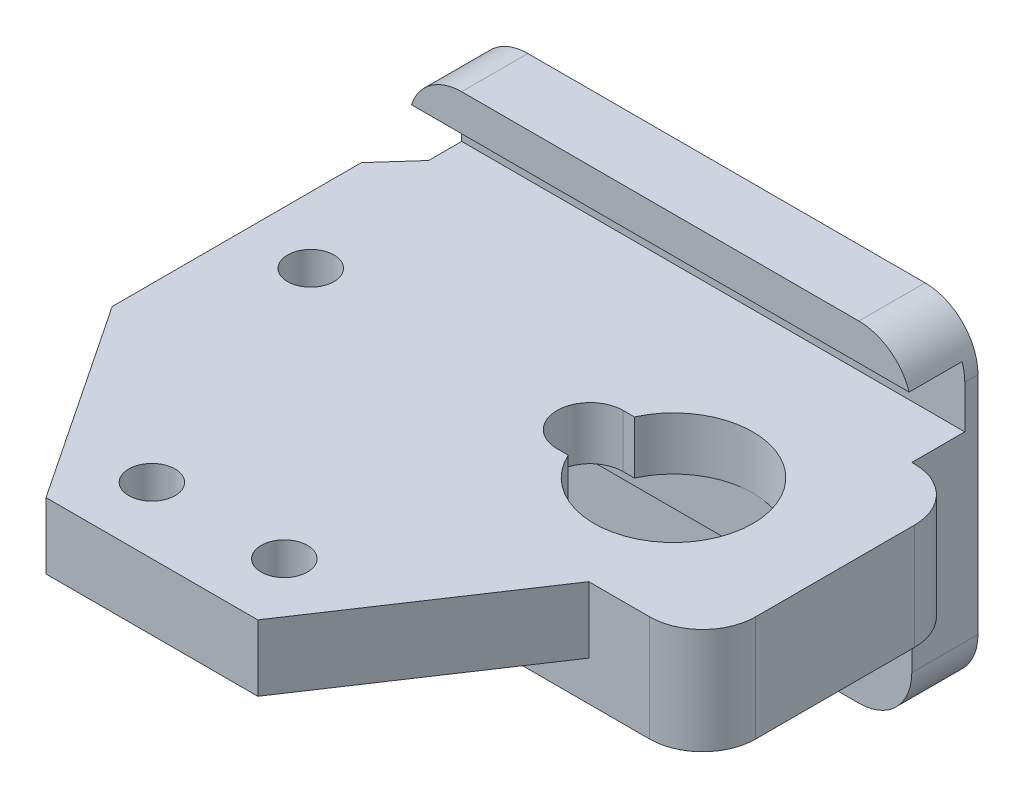
from build123d import *

# Parameters (mm, degrees)
SKETCH1_R           = 1.75
BOSS_EXTRUDE1_DEPTH = 5
SKETCH2_W           = 35
SKETCH2_H           = 20
SKETCH2_W_2         = 22.6
SKETCH2_H_2         = 12
BOSS_EXTRUDE2_DEPTH = 3
SKETCH3_W           = 15.4
SKETCH3_H           = 20
CUT_EXTRUDE1_DEPTH  = 76.166481892
SKETCH4_R           = 1
CUT_EXTRUDE2_DEPTH  = 7
SKETCH5_W           = 38
SKETCH5_H           = 25
BOSS_EXTRUDE3_DEPTH = 5
SKETCH6_R           = 2.3
CUT_EXTRUDE3_DEPTH  = 4
FILLET1_R           = 4
SKETCH2_2_W         = 22.6
SKETCH2_2_H         = 12
CUT_EXTRUDE4_DEPTH  = 1
CUT_EXTRUDE5_DEPTH  = 65.832264344
CUT_EXTRUDE6_DEPTH  = 65.627567647
SKETCH9_W           = 38
SKETCH9_H           = 4.5
CUT_EXTRUDE7_DEPTH  = 4


with BuildPart() as part:
    # Sketch1 → Boss-Extrude1 (new body)
    with BuildSketch(Plane(origin=(0, 0, 0), x_dir=(1, 0, 0), z_dir=(0, 1, 0))):
        Polygon((0, 15), (0, 33.819660113), (10, 45), (26, 45), (36, 35), (60, 35), (60, 15), (36, 15), (26, 0), (10, 0), align=None)
        with Locations((5, 25)):
            Circle(SKETCH1_R, mode=Mode.SUBTRACT)
        with Locations((13, 5)):
            Circle(SKETCH1_R, mode=Mode.SUBTRACT)
        with Locations((23, 5)):
            Circle(SKETCH1_R, mode=Mode.SUBTRACT)
    extrude(amount=BOSS_EXTRUDE1_DEPTH)

    # Sketch2 → Boss-Extrude2 (add)
    with BuildSketch(Plane.XZ):
        with Locations((27.1, -25)):
            Rectangle(SKETCH2_W, SKETCH2_H)
        with Locations((27.1, -25)):
            Rectangle(SKETCH2_W_2, SKETCH2_H_2, mode=Mode.SUBTRACT)
    extrude(amount=BOSS_EXTRUDE2_DEPTH)

    # Sketch3 → Cut-Extrude1 (cut, through all)
    with BuildSketch(Plane.XZ):
        with Locations((52.3, -25)):
            Rectangle(SKETCH3_W, SKETCH3_H)
    extrude(amount=-CUT_EXTRUDE1_DEPTH, mode=Mode.SUBTRACT)

    # Sketch4 → Cut-Extrude2 (cut)
    with BuildSketch(Plane.XZ.offset(3)):
        with Locations((13.52, -25)):
            Circle(SKETCH4_R)
        with Locations((40.67, -25)):
            Circle(SKETCH4_R)
    extrude(amount=-CUT_EXTRUDE2_DEPTH, mode=Mode.SUBTRACT)

    # Sketch5 → Boss-Extrude3 (add)
    with BuildSketch(Plane(origin=(0, 0, -35), x_dir=(-1, 0, 0), z_dir=(0, 0, -1))):
        with Locations((-21.4, -0.25)):
            Rectangle(SKETCH5_W, SKETCH5_H)
    extrude(amount=BOSS_EXTRUDE3_DEPTH)

    # Sketch6 → Cut-Extrude3 (cut)
    with BuildSketch(Plane(origin=(0, 0, -40), x_dir=(-1, 0, 0), z_dir=(0, 0, -1))):
        with Locations((-21.39853967, -0.25)):
            Circle(SKETCH6_R)
    extrude(amount=-CUT_EXTRUDE3_DEPTH, mode=Mode.SUBTRACT)

    # Fillet1
    fillet1_edges = [part.edges().sort_by_distance(p)[0] for p in [
        (2.4, -12.75, -37.5),
        (2.4, 12.25, -37.5),
        (40.4, 12.25, -37.5),
        (40.4, -12.75, -37.5),
        (44.6, 1, -35),
        (44.6, 1, -15),
    ]]
    fillet(fillet1_edges, radius=FILLET1_R)

    # Sketch2<2> → Cut-Extrude4 (cut)
    with BuildSketch(Plane.XZ):
        with Locations((27.1, -25)):
            Rectangle(SKETCH2_2_W, SKETCH2_2_H)
    extrude(amount=-CUT_EXTRUDE4_DEPTH, mode=Mode.SUBTRACT)

    # Sketch7 → Cut-Extrude5 (cut, through all)
    with BuildSketch(Plane.XZ.offset(-1)):
        with BuildLine():
            Line((26.1, -22.5), (26.945643943, -22.5))
            ThreePointArc((26.945643943, -22.5), (38.4, -25), (26.945643943, -27.5))
            Line((26.945643943, -27.5), (26.1, -27.5))
            ThreePointArc((26.1, -27.5), (23.6, -25), (26.1, -22.5))
        make_face()
    extrude(amount=-CUT_EXTRUDE5_DEPTH, mode=Mode.SUBTRACT)

    # Sketch8 → Cut-Extrude6 (cut, through all)
    with BuildSketch(Plane.XZ):
        Polygon((26, -45), (31, -40), (23.684912343, -40), (19.112166997, -40), (5.527864045, -40), (10, -45), align=None)
    extrude(amount=-CUT_EXTRUDE6_DEPTH, mode=Mode.SUBTRACT)

    # Sketch9 → Cut-Extrude7 (cut)
    with BuildSketch(Plane.XY.offset(-35)):
        with Locations((21.4, 7.25)):
            Rectangle(SKETCH9_W, SKETCH9_H)
    extrude(amount=-CUT_EXTRUDE7_DEPTH, mode=Mode.SUBTRACT)


solid = part.part
